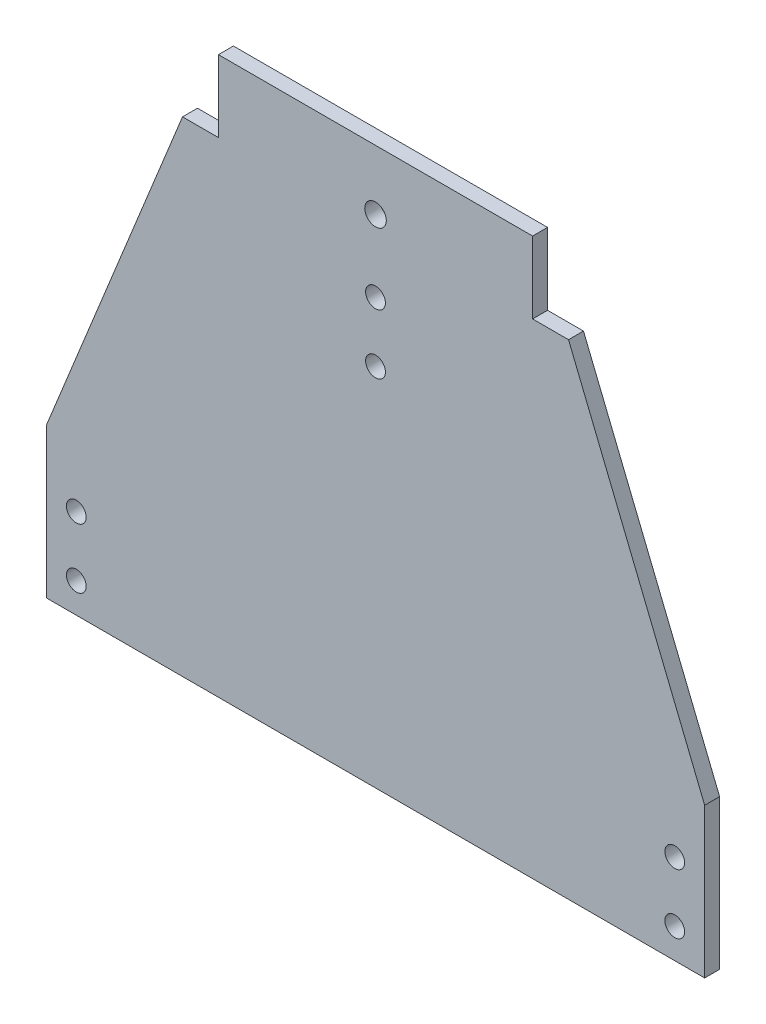
from build123d import *

# Parameters (mm, degrees)
BOSS_EXTRUDE1_DEPTH  = 2.5
M3_CLEARANCE_HOLE1_D = 3.6
SKETCH4_R            = 2.85
SKETCH4_R_2          = 1.1
BOSS_EXTRUDE3_DEPTH  = 45
SKETCH5_W            = 17.6
SKETCH5_H            = 34.321917014
SKETCH5_W_2          = 0.5
CUT_EXTRUDE1_DEPTH   = 23
SKETCH6_R            = 1.65
CUT_EXTRUDE2_DEPTH   = 10
SKETCH7_R            = 1.65
CUT_EXTRUDE3_DEPTH   = 10


with BuildPart() as part:
    # Sketch1 → Boss-Extrude1 (new body)
    with BuildSketch(Plane.XY):
        Polygon((55, -68), (32.25, -12), (26.25, -12), (26.25, 0), (0, 0), (0, -93), (55, -93), align=None)
    boss_extrude1 = extrude(amount=BOSS_EXTRUDE1_DEPTH)

    # Mirror1: Boss-Extrude1 across plane
    add(boss_extrude1.mirror(Plane(origin=(0, 0, 0), x_dir=(0, 0, 1), z_dir=(1, 0, 0))))

    # M3 Clearance Hole1 (through all)
    with Locations(Plane(origin=(0, 0, 0), x_dir=(-1, 0, 0), z_dir=(0, 0, -1))):
        with Locations((0, -10)):
            Hole(M3_CLEARANCE_HOLE1_D / 2)

    # Sketch4 → Boss-Extrude3 (add, symmetric)
    # profile 1 of 2: a face of its own
    with BuildSketch(Plane(origin=(0, 0, 0), x_dir=(0, 0, -1), z_dir=(1, 0, 0))):
        with BuildLine():
            Line((5.200247424, -91.343100719), (0, -85))
            Line((0, -85), (0, -93))
            Line((0, -93), (0.150197759, -93))
            ThreePointArc((0.150197759, -93), (2.107773739, -90.442027677), (5.200247424, -91.343100719))
        make_face()
    # profile 2 of 2: a face of its own
    with BuildSketch(Plane(origin=(0, 0, 0), x_dir=(0, 0, -1), z_dir=(1, 0, 0))):
        with Locations((2.996247653, -93.15)):
            Circle(SKETCH4_R)
        with Locations(Location((2.996247653, -93.15, 0), (0, 0, 180))):
            Circle(SKETCH4_R_2, mode=Mode.SUBTRACT)
    extrude(amount=BOSS_EXTRUDE3_DEPTH, both=True)

    # Sketch5 → Cut-Extrude1 (cut)
    with BuildSketch(Plane(origin=(0, 0, 0), x_dir=(-1, 0, 0), z_dir=(0, 0, -1))):
        with Locations((-18.1, -102.160958507)):
            Rectangle(SKETCH5_W, SKETCH5_H)
        with Locations((18.1, -102.160958507)):
            Rectangle(SKETCH5_W, SKETCH5_H)
        with Locations((-27.15, -102.160958507)):
            Rectangle(SKETCH5_W_2, SKETCH5_H)
        with Locations((-9.05, -102.160958507)):
            Rectangle(SKETCH5_W_2, SKETCH5_H)
        with Locations((9.05, -102.160958507)):
            Rectangle(SKETCH5_W_2, SKETCH5_H)
        with Locations((27.15, -102.160958507)):
            Rectangle(SKETCH5_W_2, SKETCH5_H)
    extrude(amount=CUT_EXTRUDE1_DEPTH, mode=Mode.SUBTRACT)

    # Sketch6 → Cut-Extrude2 (cut)
    with BuildSketch(Plane(origin=(0, 0, 0), x_dir=(-1, 0, 0), z_dir=(0, 0, -1))):
        with Locations((-50, -88)):
            Circle(SKETCH6_R)
        with Locations((-50, -78)):
            Circle(SKETCH6_R)
        with Locations((50, -88)):
            Circle(SKETCH6_R)
        with Locations((50, -78)):
            Circle(SKETCH6_R)
    extrude(amount=-CUT_EXTRUDE2_DEPTH, mode=Mode.SUBTRACT)

    # Sketch7 → Cut-Extrude3 (cut)
    with BuildSketch(Plane(origin=(0, 0, 0), x_dir=(-1, 0, 0), z_dir=(0, 0, -1))):
        with Locations((0, -22)):
            Circle(SKETCH7_R)
        with Locations((0, -32)):
            Circle(SKETCH7_R)
    extrude(amount=-CUT_EXTRUDE3_DEPTH, mode=Mode.SUBTRACT)


solid = part.part
